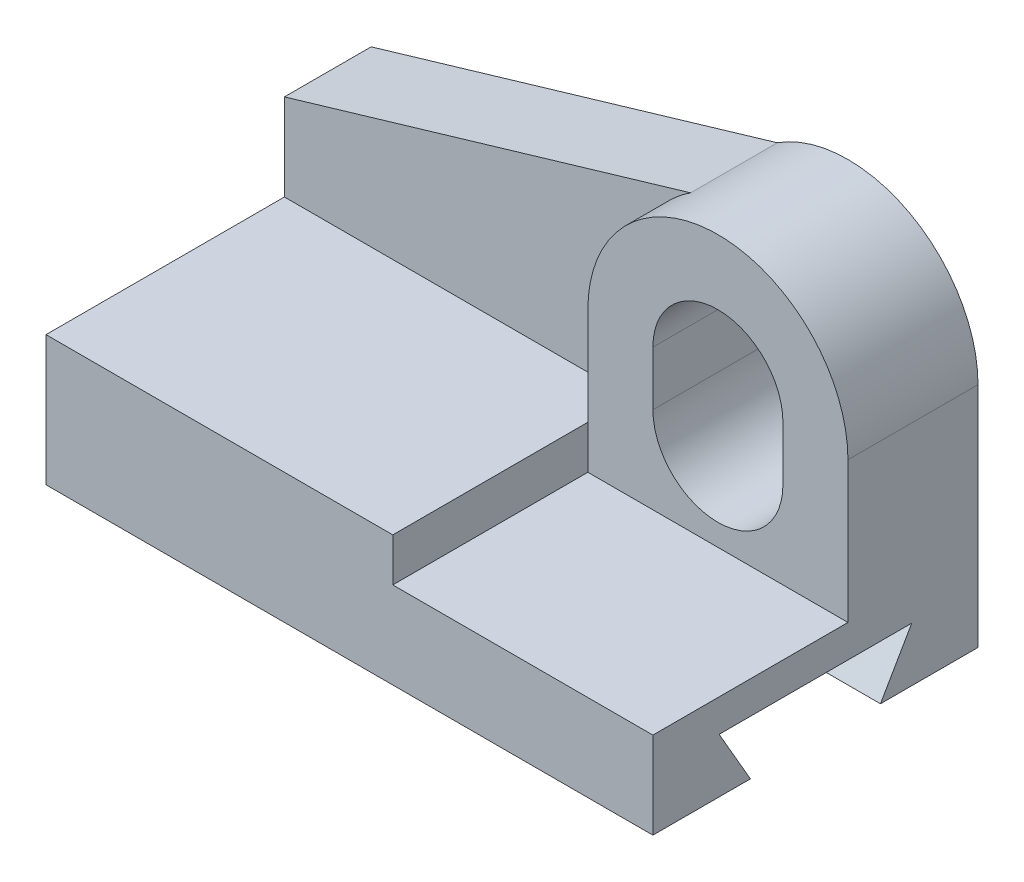
from build123d import *

# Parameters (mm, degrees)
SKETCH_2_W          = 56
SKETCH_2_H          = 30
EXTRUDE_2_DEPTH     = 12
CUT_EXTRUDE_1_DEPTH = 65.652919501
SKETCH_6_W          = 24
SKETCH_6_H          = 30
CUT_EXTRUDE_2_DEPTH = 4
SKETCH_8_W          = 10
SKETCH_8_H          = 8
EXTRUDE_1_DEPTH     = 8
SKETCH_9_W          = 24
SKETCH_9_H          = 12
EXTRUDE_3_DEPTH     = 13
SKETCH_10_R         = 12
EXTRUDE_4_DEPTH     = 12
EXTRUDE_START       = -8
EXTRUDE_5_DEPTH     = 8
CUT_EXTRUDE_3_DEPTH = 68.446274916


with BuildPart() as part:
    # 草图2 → 凸台-拉伸2 (new body)
    with BuildSketch(Plane(origin=(0, 0, 0), x_dir=(1, 0, 0), z_dir=(0, 1, 0))):
        with Locations((28, -15)):
            Rectangle(SKETCH_2_W, SKETCH_2_H)
    extrude(amount=EXTRUDE_2_DEPTH)

    # 草图4 → 切除-拉伸1 (cut, through all)
    with BuildSketch(Plane.ZY):
        Polygon((9, 0), (21, 0), (23.886751346, 5), (6.113248654, 5), align=None)
    extrude(amount=-CUT_EXTRUDE_1_DEPTH, mode=Mode.SUBTRACT)

    # 草图6 → 切除-拉伸2 (cut)
    with BuildSketch(Plane(origin=(0, 12, 0), x_dir=(1, 0, 0), z_dir=(0, 1, 0))):
        with Locations((44, -15)):
            Rectangle(SKETCH_6_W, SKETCH_6_H)
    extrude(amount=-CUT_EXTRUDE_2_DEPTH, mode=Mode.SUBTRACT)

    # 草图8 → 拉伸-薄壁1 (add)
    with BuildSketch(Plane(origin=(0, 12, 0), x_dir=(1, 0, 0), z_dir=(0, 1, 0))):
        with Locations((5, -4)):
            Rectangle(SKETCH_8_W, SKETCH_8_H)
    extrude(amount=EXTRUDE_1_DEPTH)

    # 草图9 → 凸台-拉伸3 (add)
    with BuildSketch(Plane(origin=(0, 8, 0), x_dir=(1, 0, 0), z_dir=(0, 1, 0))):
        with Locations((44, -6)):
            Rectangle(SKETCH_9_W, SKETCH_9_H)
    extrude(amount=EXTRUDE_3_DEPTH)

    # 草图10 → 凸台-拉伸4 (add)
    with BuildSketch(Plane.XY.offset(12)):
        with Locations((44, 21)):
            Circle(SKETCH_10_R)
    extrude(amount=-EXTRUDE_4_DEPTH)

    # 草图13 → 凸台-拉伸5 (add)
    with BuildSketch(Plane(origin=(0, 0, 0), x_dir=(-1, 0, 0), z_dir=(0, 0, -1)).offset(EXTRUDE_START)):
        with BuildLine():
            Line((0, 20), (-44, 33))
            ThreePointArc((-44, 33), (-44.170266358, 32.998791996), (-44.340498436, 32.995168228))
            Line((-44.340498436, 32.995168228), (-44, 10))
            Line((-44, 10), (0, 10))
            Line((0, 10), (0, 20))
        make_face()
    extrude(amount=EXTRUDE_5_DEPTH)

    # 草图14 → 切除-拉伸3 (cut, through all)
    with BuildSketch(Plane.XY.offset(12)):
        with BuildLine():
            Line((38, 21), (38, 16))
            ThreePointArc((38, 16), (44, 10), (50, 16))
            Line((50, 16), (50, 21))
            ThreePointArc((50, 21), (44, 27), (38, 21))
        make_face()
    extrude(amount=-CUT_EXTRUDE_3_DEPTH, mode=Mode.SUBTRACT)


solid = part.part
